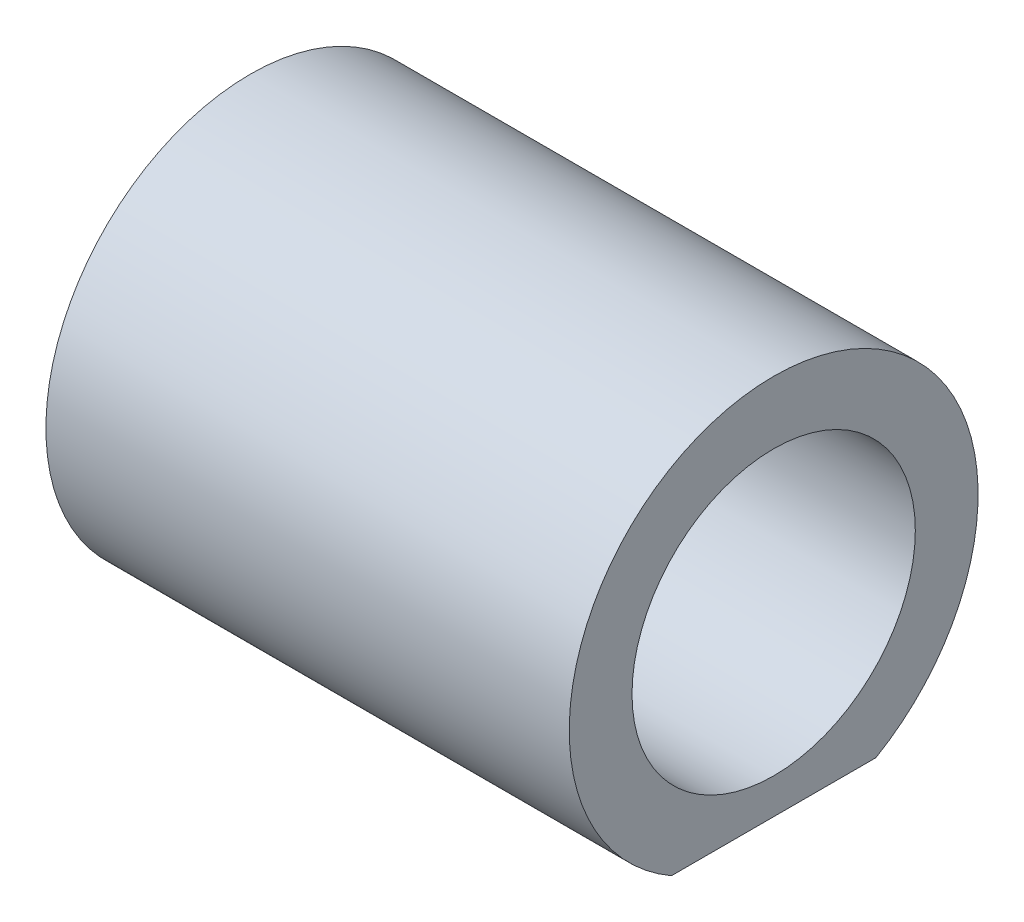
from build123d import *

# Parameters (mm, degrees)
SKETCH1_R           = 5.500000049
BOSS_EXTRUDE1_DEPTH = 20.32


with BuildPart() as part:
    # Sketch1 → Boss-Extrude1 (new body)
    with BuildSketch(Plane.YZ):
        with BuildLine():
            Line((-6.874076643, -3.96875), (-6.874076643, 3.96875))
            ThreePointArc((-6.874076643, 3.96875), (7.9375, 0), (-6.874076643, -3.96875))
        make_face()
        with Locations(Location((0, 0, 0), (0, 0, 270))):
            Circle(SKETCH1_R, mode=Mode.SUBTRACT)
    extrude(amount=BOSS_EXTRUDE1_DEPTH)


solid = part.part
